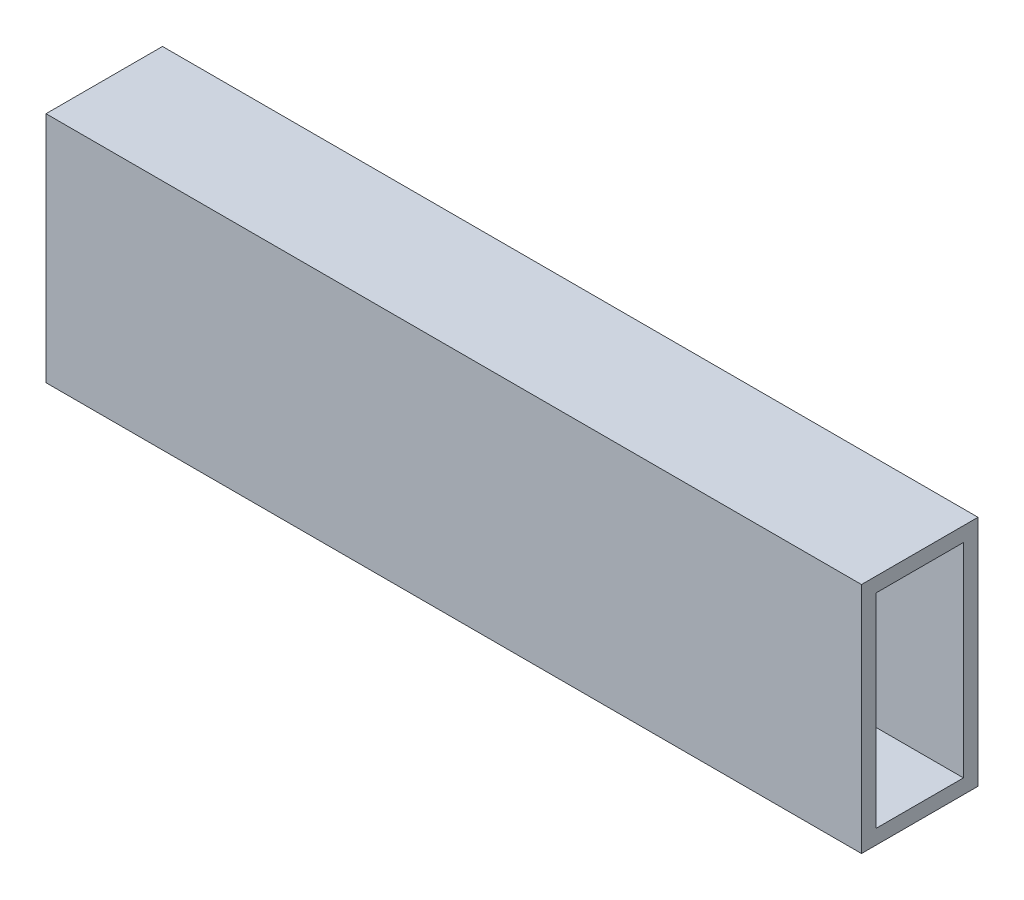
from build123d import *

# Parameters (mm, degrees)
SKETCH1_W           = 177.8
SKETCH1_H           = 50.8
BOSS_EXTRUDE1_DEPTH = 25.4
SKETCH2_W           = 19.05
SKETCH2_H           = 44.45
CUT_EXTRUDE1_DEPTH  = 187.6511184


with BuildPart() as part:
    # Sketch1 → Boss-Extrude1 (new body)
    with BuildSketch(Plane.XY):
        with Locations((88.9, -25.4)):
            Rectangle(SKETCH1_W, SKETCH1_H)
    extrude(amount=BOSS_EXTRUDE1_DEPTH)

    # Sketch2 → Cut-Extrude1 (cut, through all)
    with BuildSketch(Plane(origin=(177.8, 0, 0), x_dir=(0, 0, -1), z_dir=(1, 0, 0))):
        with Locations((-12.7, -25.4)):
            Rectangle(SKETCH2_W, SKETCH2_H)
    extrude(amount=-CUT_EXTRUDE1_DEPTH, mode=Mode.SUBTRACT)


solid = part.part
